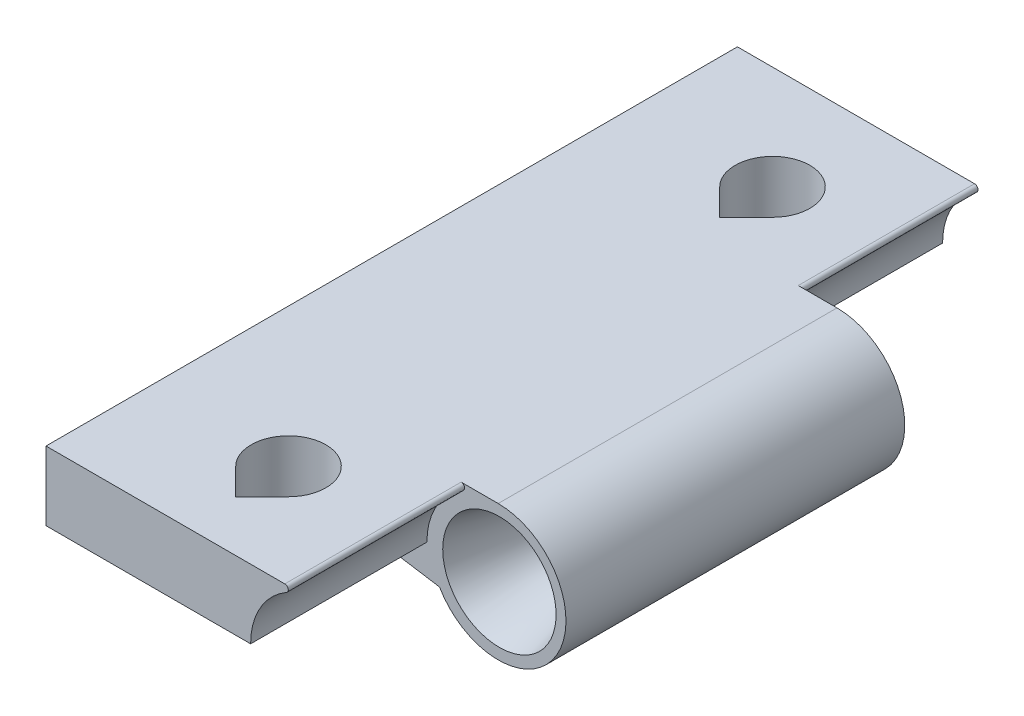
from build123d import *

# Parameters (mm, degrees)
BOSS_EXTRUDE1_DEPTH = 12.75
BOSS_EXTRUDE2_DEPTH = 24.5
BOSS_EXTRUDE3_DEPTH = 12.75
CUT_EXTRUDE1_DEPTH  = 34.504705063
CUT_EXTRUDE2_DEPTH  = 34.504705063


with BuildPart() as part:
    # Sketch1 → Boss-Extrude1 (new body)
    with BuildSketch(Plane(origin=(0, 0, -25), x_dir=(-1, 0, 0), z_dir=(0, 0, -1))):
        with BuildLine():
            Line((5.2, 0), (20.038095252, 0))
            Line((20.038095252, 0), (20.038095252, 4.871341922))
            Line((20.038095252, 4.871341922), (2.890551941, 4.871341922))
            ThreePointArc((2.890551941, 4.871341922), (2.649795512, 4.689964666), (2.757716863, 4.408514229))
            ThreePointArc((2.757716863, 4.408514229), (4.548633184, 2.519907966), (5.2, 0))
        make_face()
    extrude(amount=-BOSS_EXTRUDE1_DEPTH)

    # Sketch2 → Boss-Extrude2 (add)
    with BuildSketch(Plane.XY.offset(-12.25)):
        with BuildLine():
            Line((-20.038095252, 4.871341922), (-0.08660254, 4.871341922))
            ThreePointArc((-0.08660254, 4.871341922), (4.156921938, -2.478658078), (-4.330127019, -2.478658078))
            Line((-4.330127019, -2.478658078), (-20.038095252, 0.021341922))
            Line((-20.038095252, 0.021341922), (-20.038095252, 4.871341922))
        make_face()
    extrude(amount=BOSS_EXTRUDE2_DEPTH)

    # Sketch3 → Boss-Extrude3 (add)
    with BuildSketch(Plane.XY.offset(12.25)):
        with BuildLine():
            Line((-20.038095252, 4.871341922), (-2.767593084, 4.871341922))
            ThreePointArc((-2.767593084, 4.871341922), (-2.52626626, 4.686621046), (-2.641564255, 4.405432834))
            ThreePointArc((-2.641564255, 4.405432834), (-4.544193916, 2.489173945), (-5.24, -0.12002165))
            Line((-5.24, -0.12002165), (-20.038095252, -0.12002165))
            Line((-20.038095252, -0.12002165), (-20.038095252, 4.871341922))
        make_face()
    extrude(amount=BOSS_EXTRUDE3_DEPTH)

    # Sketch4 → Cut-Extrude1 (cut, through all)
    with BuildSketch(Plane(origin=(0, 4.871341922, 0), x_dir=(-1, 0, 0), z_dir=(0, 1, 0))):
        with BuildLine():
            Line((10, -13.681623382), (8.090811691, -15.590811691))
            ThreePointArc((8.090811691, -15.590811691), (10, -20.2), (11.909188309, -15.590811691))
            Line((11.909188309, -15.590811691), (10, -13.681623382))
        make_face()
    extrude(amount=-CUT_EXTRUDE1_DEPTH, mode=Mode.SUBTRACT)

    # Sketch5 → Cut-Extrude2 (cut, through all)
    with BuildSketch(Plane(origin=(0, 4.871341922, 0), x_dir=(-1, 0, 0), z_dir=(0, 1, 0))):
        with BuildLine():
            Line((10, 21.318376618), (8.090811691, 19.409188309))
            ThreePointArc((8.090811691, 19.409188309), (10, 14.8), (11.909188309, 19.409188309))
            Line((11.909188309, 19.409188309), (10, 21.318376618))
        make_face()
    extrude(amount=-CUT_EXTRUDE2_DEPTH, mode=Mode.SUBTRACT)

    # Sketch6 → Cut-Revolve1 (revolve, cut)
    with BuildSketch(Plane.XZ, mode=Mode.PRIVATE) as cut_revolve1_sk:
        with BuildLine():
            Line((4.1, 12.25), (0, 12.25))
            Line((0, 12.25), (0, -12.25))
            Line((0, -12.25), (4.182916362, -12.25))
            ThreePointArc((4.182916362, -12.25), (2.257265667, -0.006376751), (4.1, 12.25))
        make_face()
    revolve(cut_revolve1_sk.sketch.rotate(Axis((0, 0, 12.25), (0, 0, -1)), 180), axis=Axis((0, 0, 12.25), (0, 0, -1)), mode=Mode.SUBTRACT)


solid = part.part
